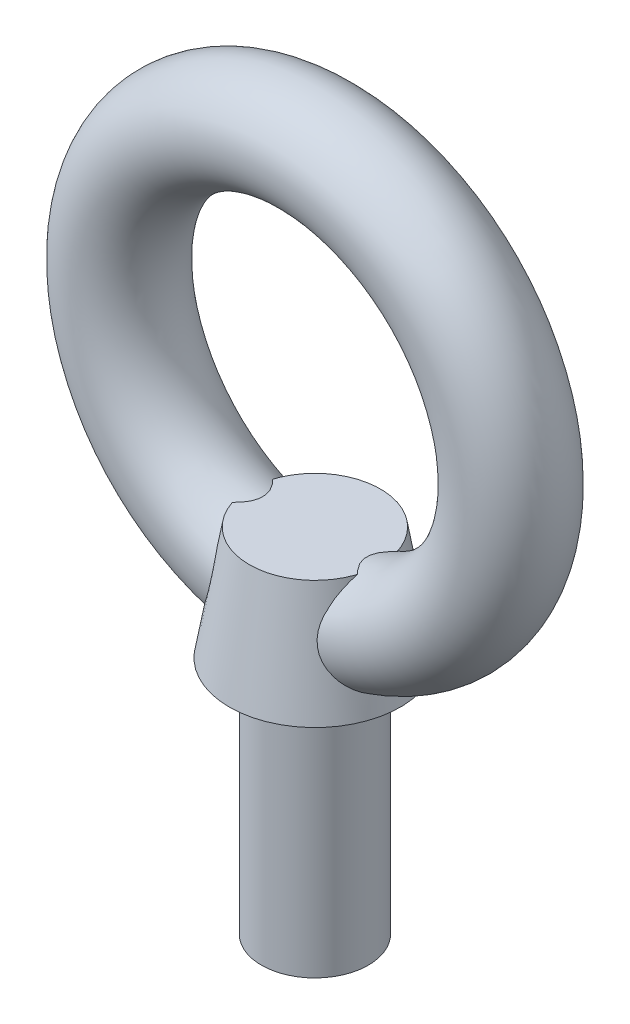
from build123d import *

# Parameters (mm, degrees)
ESQUISSE2_R        = 2.4
BOSS_EXTRU_1_START = -11.6
ESQUISSE3_R        = 4
BOSS_EXTRU_1_DEPTH = 5.3
BOSS_EXTRU_1_TAPER = 10
ESQUISSE4_R        = 2.5
BOSS_EXTRU_2_DEPTH = 11.2


with BuildPart() as part:
    # Esquisse2 → Révolution1 (revolve)
    with BuildSketch(Plane(origin=(0, 0, 0), x_dir=(1, 0, 0), z_dir=(0, 1, 0))):
        with Locations((9.155, 0)):
            Circle(ESQUISSE2_R)
    revolve(axis=Axis((0, 0, 0), (0, 0, -1)))


with BuildPart() as body_2:
    # Esquisse3 → Boss.-Extru.1 (new body)
    with BuildSketch(Plane(origin=(0, 0, 0), x_dir=(1, 0, 0), z_dir=(0, 1, 0)).offset(BOSS_EXTRU_1_START)):
        Circle(ESQUISSE3_R)
    extrude(amount=BOSS_EXTRU_1_DEPTH, taper=BOSS_EXTRU_1_TAPER)

    # Esquisse4 → Boss.-Extru.2 (add)
    with BuildSketch(Plane.XZ.offset(11.6)):
        with Locations(Location((0, 0, 0), (0, 0, 270))):
            Circle(ESQUISSE4_R)
    extrude(amount=BOSS_EXTRU_2_DEPTH)


solid = Compound([part.part, body_2.part])
